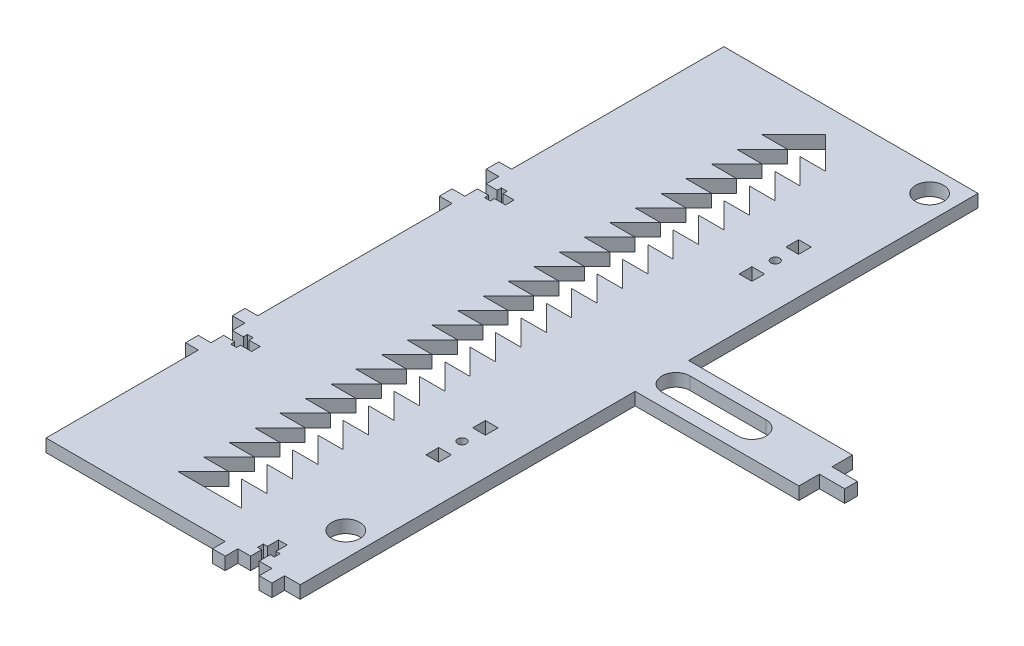
from build123d import *

# Parameters (mm, degrees)
AXLE_SUPPORT_PLATE_R   = 7.030128061
AXLE_SUPPORT_PLATE_R_2 = 2.159
AXLE_SUPPORT_PLATE_W   = 6.35
AXLE_SUPPORT_PLATE_H   = 6.35
BOSS_EXTRUDE1_DEPTH    = 6.35


with BuildPart() as part:
    # Axle Support Plate → Boss-Extrude1 (new body)
    with BuildSketch(Plane(origin=(0, 0, 0), x_dir=(1, 0, 0), z_dir=(0, 1, 0))):
        Polygon((63.58606403, -169.56756403), (63.58606403, -1.972692091), (145.546192091, -1.972692091), (145.546192091, 8.23243597), (158.246192091, 8.23243597), (158.246192091, 14.58243597), (145.546192091, 14.58243597), (145.546192091, 24.78756403), (63.58606403, 24.78756403), (63.58606403, 169.56756403), (-63.58606403, 169.56756403), (-63.58606403, 63.35043597), (-69.93606403, 63.35043597), (-69.93606403, 57.00043597), (-63.58606403, 57.00043597), (-63.58606403, 50.65043597), (-58.051064051, 50.65043597), (-58.051064051, 52.691435952), (-55.151064009, 52.691435952), (-55.151064009, 50.65043597), (-49.61606403, 50.65043597), (-49.61606403, 46.33243597), (-55.151064009, 46.33243597), (-55.151064009, 44.291435988), (-58.051064051, 44.291435988), (-58.051064051, 46.33243597), (-63.58606403, 46.33243597), (-63.58606403, 39.98243597), (-69.93606403, 39.98243597), (-69.93606403, 33.63243597), (-63.58606403, 33.63243597), (-63.58606403, -63.64956403), (-69.93606403, -63.64956403), (-69.93606403, -69.99956403), (-63.58606403, -69.99956403), (-63.58606403, -76.34956403), (-58.051064051, -76.34956403), (-58.051064051, -74.308564048), (-55.151064009, -74.308564048), (-55.151064009, -76.34956403), (-49.61606403, -76.34956403), (-49.61606403, -80.66756403), (-55.151064009, -80.66756403), (-55.151064009, -82.708564012), (-58.051064051, -82.708564012), (-58.051064051, -80.66756403), (-63.58606403, -80.66756403), (-63.58606403, -87.01756403), (-69.93606403, -87.01756403), (-69.93606403, -93.36756403), (-63.58606403, -93.36756403), (-63.58606403, -169.56756403), (26.07593597, -169.56756403), (26.07593597, -175.91756403), (32.42593597, -175.91756403), (32.42593597, -169.56756403), (38.77593597, -169.56756403), (38.77593597, -164.032564051), (36.734935988, -164.032564051), (36.734935988, -161.132564009), (38.77593597, -161.132564009), (38.77593597, -155.59756403), (43.09393597, -155.59756403), (43.09393597, -161.132564009), (45.134935952, -161.132564009), (45.134935952, -164.032564051), (43.09393597, -164.032564051), (43.09393597, -169.56756403), (49.44393597, -169.56756403), (49.44393597, -175.91756403), (55.79393597, -175.91756403), (55.79393597, -169.56756403), align=None)
        with Locations(Location((51.47593597, 157.45743597, 0), (0, 0, 270))):
            Circle(AXLE_SUPPORT_PLATE_R, mode=Mode.SUBTRACT)
        with Locations(Location((51.47593597, -134.64256403, 0), (0, 0, 270))):
            Circle(AXLE_SUPPORT_PLATE_R, mode=Mode.SUBTRACT)
        with Locations(Location((41.95093597, 89.76643597, 0), (0, 0, 270))):
            Circle(AXLE_SUPPORT_PLATE_R_2, mode=Mode.SUBTRACT)
        with Locations(Location((41.95093597, -66.95156403, 0), (0, 0, 270))):
            Circle(AXLE_SUPPORT_PLATE_R_2, mode=Mode.SUBTRACT)
        Polygon((0, 156.86756403), (-15.875, 140.99256403), (-3.175, 140.99256403), (-15.875, 128.29256403), (-3.175, 128.29256403), (-15.875, 115.59256403), (-3.175, 115.59256403), (-15.875, 102.89256403), (-3.175, 102.89256403), (-15.875, 90.19256403), (-3.175, 90.19256403), (-15.875, 77.49256403), (-3.175, 77.49256403), (-15.875, 64.79256403), (-3.175, 64.79256403), (-15.875, 52.09256403), (-3.175, 52.09256403), (-15.875, 39.39256403), (-3.175, 39.39256403), (-15.875, 26.69256403), (-3.175, 26.69256403), (-15.875, 13.99256403), (-3.175, 13.99256403), (-15.875, 1.29256403), (-3.175, 1.29256403), (-15.875, -11.40743597), (-3.175, -11.40743597), (-15.875, -24.10743597), (-3.175, -24.10743597), (-15.875, -36.80743597), (-3.175, -36.80743597), (-15.875, -49.50743597), (-3.175, -49.50743597), (-15.875, -62.20743597), (-3.175, -62.20743597), (-15.875, -74.90743597), (-3.175, -74.90743597), (-15.875, -87.60743597), (-3.175, -87.60743597), (-15.875, -100.30743597), (-3.175, -100.30743597), (-15.875, -113.00743597), (-3.175, -113.00743597), (-15.875, -125.70743597), (-3.175, -125.70743597), (-15.875, -138.40743597), (-3.175, -138.40743597), (-15.875, -151.10743597), (15.875, -151.10743597), (3.175, -138.40743597), (15.875, -138.40743597), (3.175, -125.70743597), (15.875, -125.70743597), (3.175, -113.00743597), (15.875, -113.00743597), (3.175, -100.30743597), (15.875, -100.30743597), (3.175, -87.60743597), (15.875, -87.60743597), (3.175, -74.90743597), (15.875, -74.90743597), (3.175, -62.20743597), (15.875, -62.20743597), (3.175, -49.50743597), (15.875, -49.50743597), (3.175, -36.80743597), (15.875, -36.80743597), (3.175, -24.10743597), (15.875, -24.10743597), (3.175, -11.40743597), (15.875, -11.40743597), (3.175, 1.29256403), (15.875, 1.29256403), (3.175, 13.99256403), (15.875, 13.99256403), (3.175, 26.69256403), (15.875, 26.69256403), (3.175, 39.39256403), (15.875, 39.39256403), (3.175, 52.09256403), (15.875, 52.09256403), (3.175, 64.79256403), (15.875, 64.79256403), (3.175, 77.49256403), (15.875, 77.49256403), (3.175, 90.19256403), (15.875, 90.19256403), (3.175, 102.89256403), (15.875, 102.89256403), (3.175, 115.59256403), (15.875, 115.59256403), (3.175, 128.29256403), (15.875, 128.29256403), (3.175, 140.99256403), (15.875, 140.99256403), align=None, mode=Mode.SUBTRACT)
        with BuildLine():
            Line((70.616192091, 18.43756403), (108.716192091, 18.43756403))
            ThreePointArc((108.716192091, 18.43756403), (115.746320151, 11.40743597), (108.716192091, 4.377307909))
            Line((108.716192091, 4.377307909), (70.616192091, 4.377307909))
            ThreePointArc((70.616192091, 4.377307909), (63.58606403, 11.40743597), (70.616192091, 18.43756403))
        make_face(mode=Mode.SUBTRACT)
        with Locations((41.95093597, 101.45043597)):
            Rectangle(AXLE_SUPPORT_PLATE_W, AXLE_SUPPORT_PLATE_H, mode=Mode.SUBTRACT)
        with Locations((41.95093597, 78.08243597)):
            Rectangle(AXLE_SUPPORT_PLATE_W, AXLE_SUPPORT_PLATE_H, mode=Mode.SUBTRACT)
        with Locations((41.95093597, -78.63556403)):
            Rectangle(AXLE_SUPPORT_PLATE_W, AXLE_SUPPORT_PLATE_H, mode=Mode.SUBTRACT)
        with Locations((41.95093597, -55.26756403)):
            Rectangle(AXLE_SUPPORT_PLATE_W, AXLE_SUPPORT_PLATE_H, mode=Mode.SUBTRACT)
    extrude(amount=BOSS_EXTRUDE1_DEPTH)


solid = part.part
